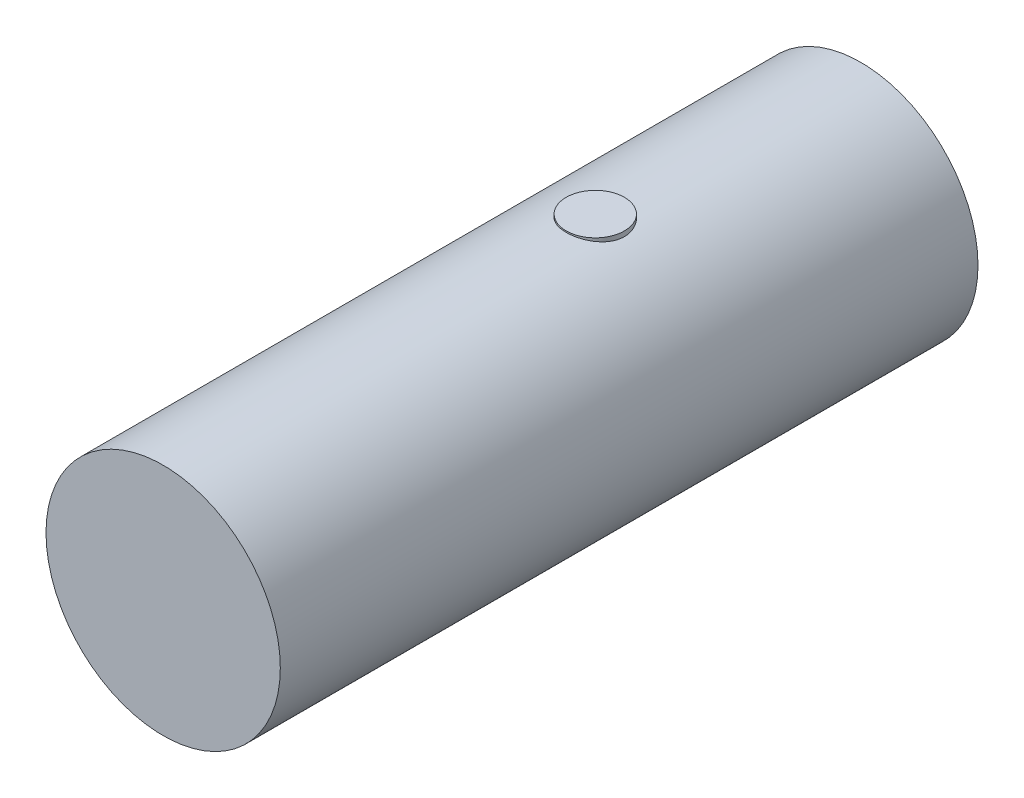
from build123d import *

# Parameters (mm, degrees)
SKIZZE1_R                            = 89
AUFSATZ_LINEAR_AUSTRAGEN1_DEPTH      = 530
AUFSATZ_LINEAR_AUSTRAGEN2_DEPTH      = 90
AUFSATZ_LINEAR_AUSTRAGEN2_DEPTH_BACK = 90
SKIZZE2_R                            = 22.126613263


with BuildPart() as part:
    # Skizze1 → Aufsatz-Linear austragen1 (new body)
    with BuildSketch(Plane.XY):
        Circle(SKIZZE1_R)
    extrude(amount=AUFSATZ_LINEAR_AUSTRAGEN1_DEPTH)

    # Skizze2 → Aufsatz-Linear austragen2 (add, two sides: drawn at the far end of the back side and taken through both)
    with BuildSketch(Plane(origin=(0, 0, 0), x_dir=(1, 0, 0), z_dir=(0, 1, 0)).offset(-AUFSATZ_LINEAR_AUSTRAGEN2_DEPTH_BACK)):
        with Locations((0, -201.710109628)):
            Circle(SKIZZE2_R)
    extrude(amount=AUFSATZ_LINEAR_AUSTRAGEN2_DEPTH + AUFSATZ_LINEAR_AUSTRAGEN2_DEPTH_BACK)


solid = part.part
